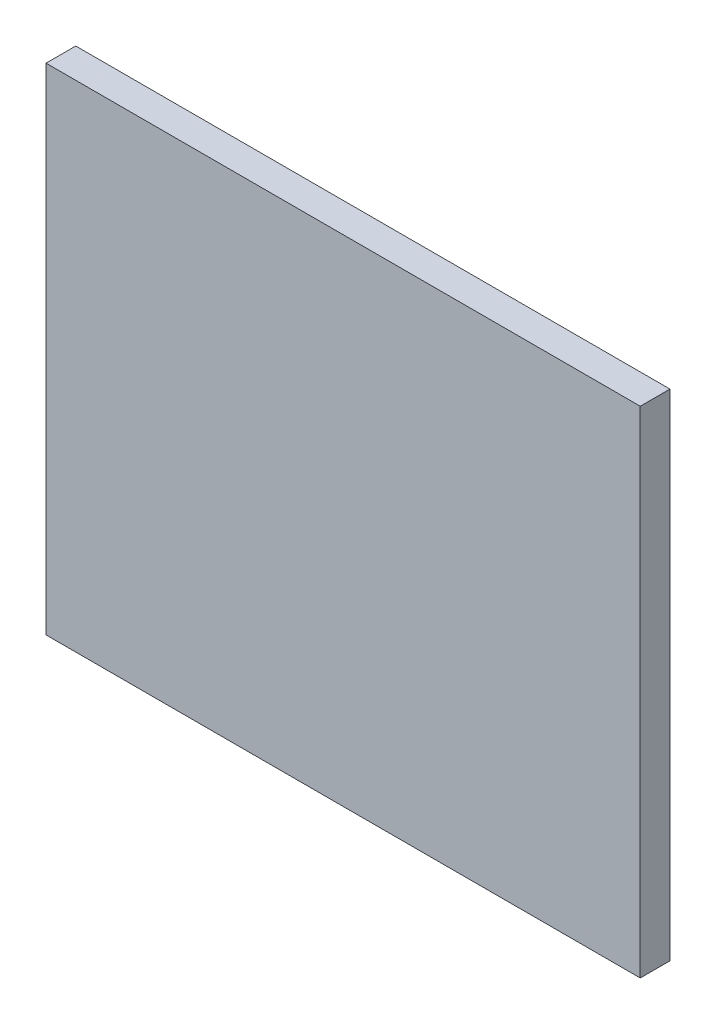
from build123d import *

# Parameters (mm, degrees)
SKETCH1_W           = 60
SKETCH1_H           = 3
BOSS_EXTRUDE1_DEPTH = 50


with BuildPart() as part:
    # Sketch1 → Boss-Extrude1 (new body)
    with BuildSketch(Plane(origin=(0, 0, 0), x_dir=(1, 0, 0), z_dir=(0, 1, 0))):
        Rectangle(SKETCH1_W, SKETCH1_H)
    extrude(amount=BOSS_EXTRUDE1_DEPTH)


solid = part.part
